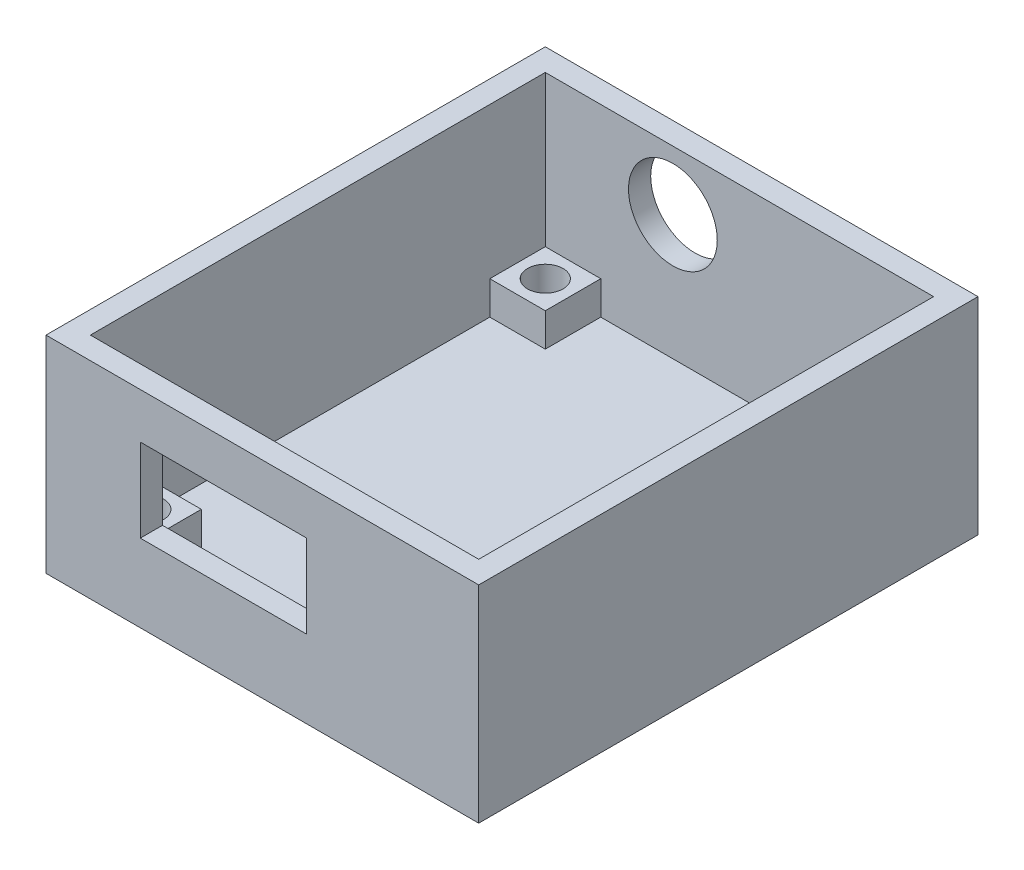
from build123d import *

# Parameters (mm, degrees)
SKETCH1_W             = 39
SKETCH1_H             = 45
BODY_DEPTH            = 18.6
SHELL1_T              = -2
SKETCH3_W             = 5
SKETCH3_H             = 5
INSERTS_SUPPORT_DEPTH = 3
SKETCH4_R             = 1.6
INSERTS_HOLES_DEPTH   = 4
USB_HOLE_REACH        = 54.452
SKETCH5_W             = 15
SKETCH5_H             = 7.5
JACK_HOLE_REACH       = 54.452
SKETCH6_R             = 4


with BuildPart() as part:
    # Sketch1 → Body (new body)
    with BuildSketch(Plane(origin=(0, 0, 0), x_dir=(1, 0, 0), z_dir=(0, 1, 0))):
        Rectangle(SKETCH1_W, SKETCH1_H)
    extrude(amount=BODY_DEPTH)

    # Shell1
    shell1_openings = [part.faces().sort_by_distance(p)[0] for p in [
        (0, 18.6, 0),
    ]]
    offset(amount=SHELL1_T, openings=shell1_openings, kind=Kind.INTERSECTION)

    # Sketch3 → Inserts_Support (add)
    with BuildSketch(Plane(origin=(0, 2, 0), x_dir=(1, 0, 0), z_dir=(0, 1, 0))):
        with Locations((-15, 18)):
            Rectangle(SKETCH3_W, SKETCH3_H)
        with Locations((15, 18)):
            Rectangle(SKETCH3_W, SKETCH3_H)
        with Locations((15, -18)):
            Rectangle(SKETCH3_W, SKETCH3_H)
        with Locations((-15, -18)):
            Rectangle(SKETCH3_W, SKETCH3_H)
    extrude(amount=INSERTS_SUPPORT_DEPTH)

    # Sketch4 → Inserts_Holes (cut)
    with BuildSketch(Plane(origin=(0, 5, 0), x_dir=(1, 0, 0), z_dir=(0, 1, 0))):
        with Locations(Location((-15, 18, 0), (0, 0, 270))):
            Circle(SKETCH4_R)
        with Locations(Location((15, 18, 0), (0, 0, 270))):
            Circle(SKETCH4_R)
        with Locations(Location((15, -18, 0), (0, 0, 270))):
            Circle(SKETCH4_R)
        with Locations(Location((-15, -18, 0), (0, 0, 270))):
            Circle(SKETCH4_R)
    extrude(amount=-INSERTS_HOLES_DEPTH, mode=Mode.SUBTRACT)

    # Sketch5 → USB_Hole (cut, up to next)
    with BuildSketch(Plane.XY.offset(22.5), mode=Mode.PRIVATE) as usb_hole_sk1:
        with Locations((-3.5, 10.75)):
            Rectangle(SKETCH5_W, SKETCH5_H)
    usb_hole_tool1 = extrude(usb_hole_sk1.sketch, amount=-USB_HOLE_REACH, mode=Mode.PRIVATE) & part.part
    add(usb_hole_tool1.solids().sort_by_distance((-3.5, 10.75, 22.5))[0], mode=Mode.SUBTRACT)

    # Sketch6 → Jack_Hole (cut, up to next)
    with BuildSketch(Plane(origin=(0, 0, -22.5), x_dir=(-1, 0, 0), z_dir=(0, 0, -1)), mode=Mode.PRIVATE) as jack_hole_sk1:
        with Locations((6, 13.25)):
            Circle(SKETCH6_R)
    jack_hole_tool1 = extrude(jack_hole_sk1.sketch, amount=-JACK_HOLE_REACH, mode=Mode.PRIVATE) & part.part
    add(jack_hole_tool1.solids().sort_by_distance((-6, 13.25, -22.5))[0], mode=Mode.SUBTRACT)


solid = part.part
